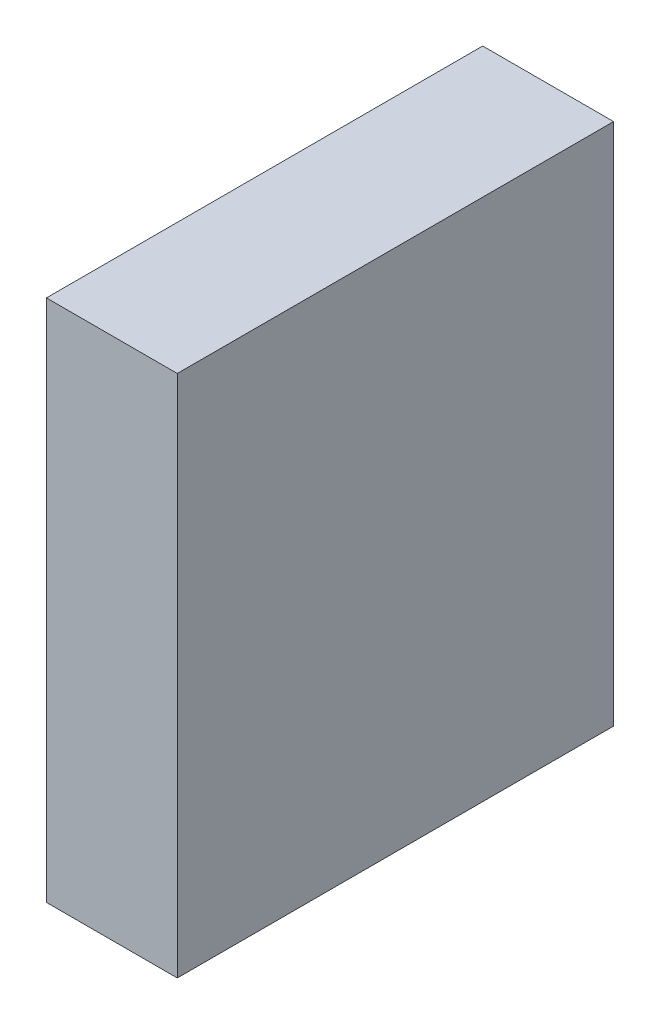
from build123d import *

# Parameters (mm, degrees)
SKETCH1_W           = 3
SKETCH1_H           = 12
BOSS_EXTRUDE2_DEPTH = 10


with BuildPart() as part:
    # Sketch1 → Boss-Extrude2 (new body)
    with BuildSketch(Plane.XY):
        with Locations((0.227848101, -2.136075949)):
            Rectangle(SKETCH1_W, SKETCH1_H)
    extrude(amount=BOSS_EXTRUDE2_DEPTH)


solid = part.part
